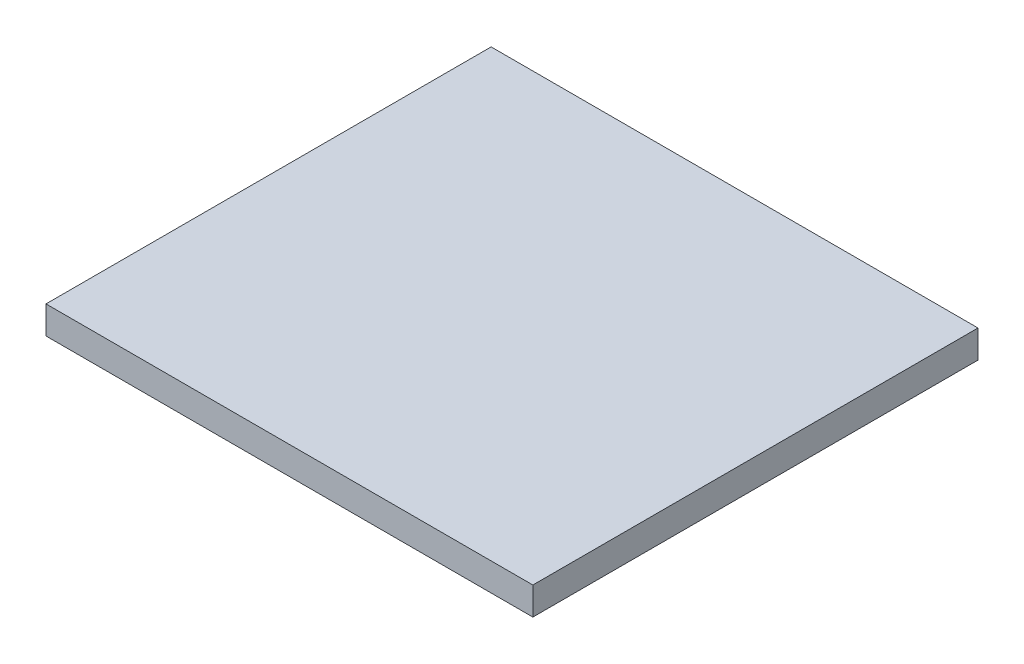
from build123d import *

# Parameters (mm, degrees)
SKETCH1_W             = 17.5
SKETCH1_H             = 16
BOSS_EXTRUDE1_DEPTH   = 1
BODY_MOVE_COPY1_ANGLE = 90


with BuildPart() as part:
    # Sketch1 → Boss-Extrude1 (new body)
    with BuildSketch(Plane.XY):
        with Locations((58.938888889, 8.105555556)):
            Rectangle(SKETCH1_W, SKETCH1_H)
    extrude(amount=BOSS_EXTRUDE1_DEPTH)


with BuildPart() as part_1:
    # Body-Move/Copy1: moved
    add(part.part.rotate(Axis((0, 8.105555556, 0.25), (1, 0, 0)), BODY_MOVE_COPY1_ANGLE))


solid = part_1.part
